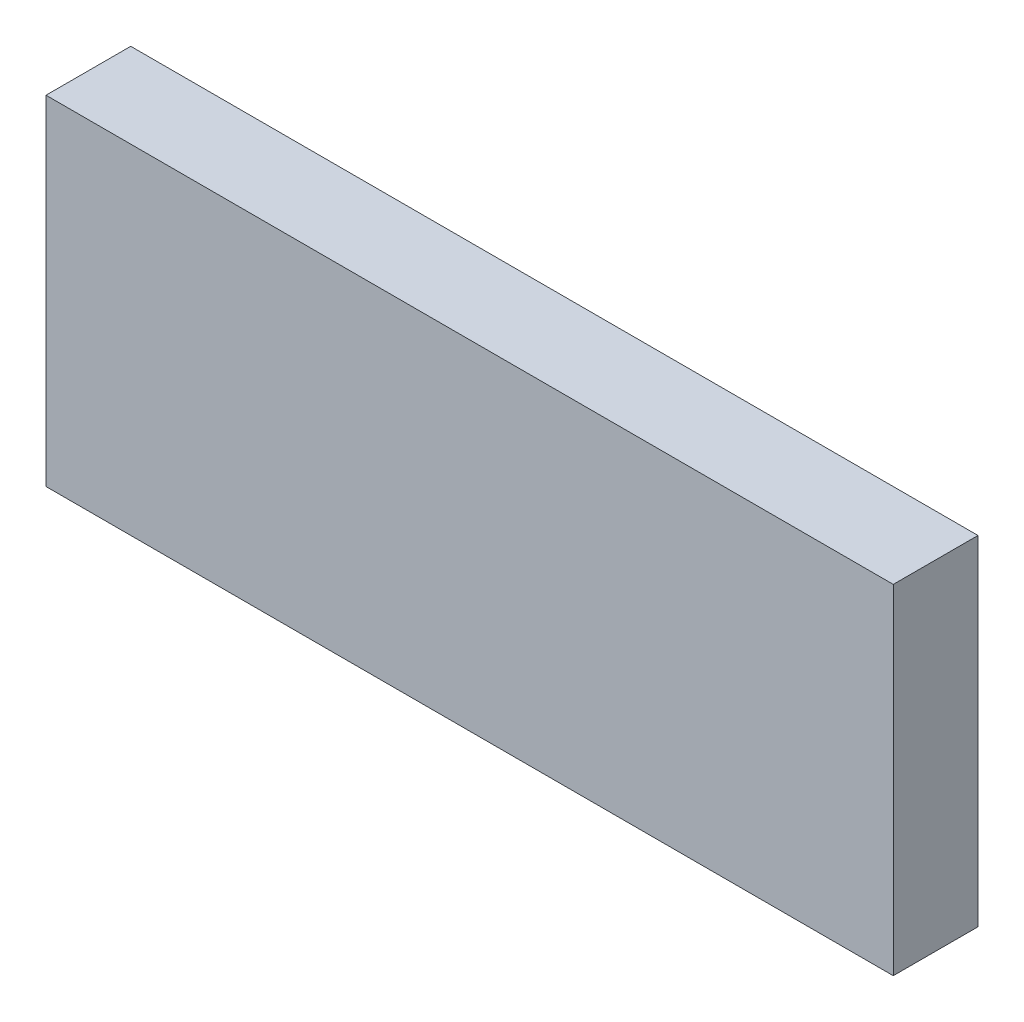
from build123d import *

# Parameters (mm, degrees)
CROQUIS2_W              = 500
CROQUIS2_H              = 200
SALIENTE_EXTRUIR1_DEPTH = 50


with BuildPart() as part:
    # Croquis2 → Saliente-Extruir1 (new body)
    with BuildSketch(Plane.XY):
        with Locations((250, 100)):
            Rectangle(CROQUIS2_W, CROQUIS2_H)
    extrude(amount=SALIENTE_EXTRUIR1_DEPTH)


solid = part.part
